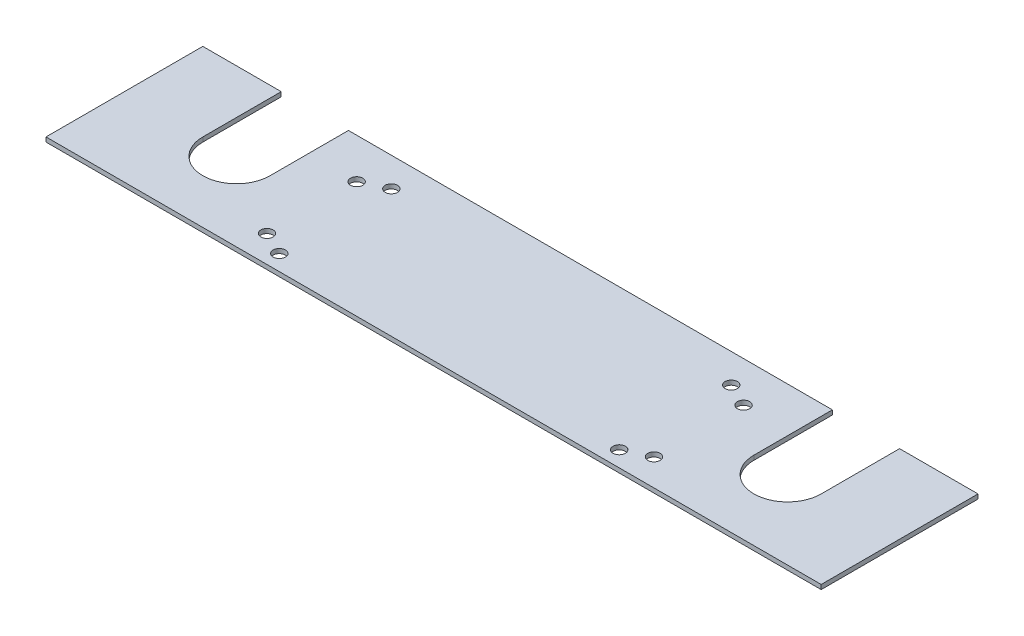
from build123d import *

# Parameters (mm, degrees)
SKETCH1_W            = 346
SKETCH1_H            = 2
BOSS_EXTRUDE1_DEPTH  = 70
M5_CLEARANCE_HOLE1_D = 5.5
CUT_EXTRUDE1_DEPTH   = 10


with BuildPart() as part:
    # Sketch1 → Boss-Extrude1 (new body)
    with BuildSketch(Plane.XY):
        Rectangle(SKETCH1_W, SKETCH1_H)
    extrude(amount=BOSS_EXTRUDE1_DEPTH)

    # M5 Clearance Hole1 (through all)
    with Locations(Plane(origin=(86.36, 1, 18), x_dir=(1, 0, 0), z_dir=(0, 1, 0))):
        with Locations((0, 0), (-10.5, 5), (0, -40), (-10.5, -45)):
            m5_clearance_hole1 = Hole(M5_CLEARANCE_HOLE1_D / 2)

    # Mirror1: M5 Clearance Hole1 across plane
    add(m5_clearance_hole1.mirror(Plane(origin=(0, 0, 0), x_dir=(0, 0, 1), z_dir=(1, 0, 0))), mode=Mode.SUBTRACT)

    # Sketch4 → Cut-Extrude1 (cut)
    with BuildSketch(Plane(origin=(0, 1, 0), x_dir=(1, 0, 0), z_dir=(0, 1, 0))):
        with BuildLine():
            Line((138, -35), (138, 0))
            Line((138, 0), (108, 0))
            Line((108, 0), (108, -35))
            ThreePointArc((108, -35), (123, -50), (138, -35))
        make_face()
        with BuildLine():
            Line((-108, -35), (-108, 0))
            Line((-108, 0), (-138, 0))
            Line((-138, 0), (-138, -35))
            ThreePointArc((-138, -35), (-123, -50), (-108, -35))
        make_face()
    extrude(amount=-CUT_EXTRUDE1_DEPTH, mode=Mode.SUBTRACT)


solid = part.part
